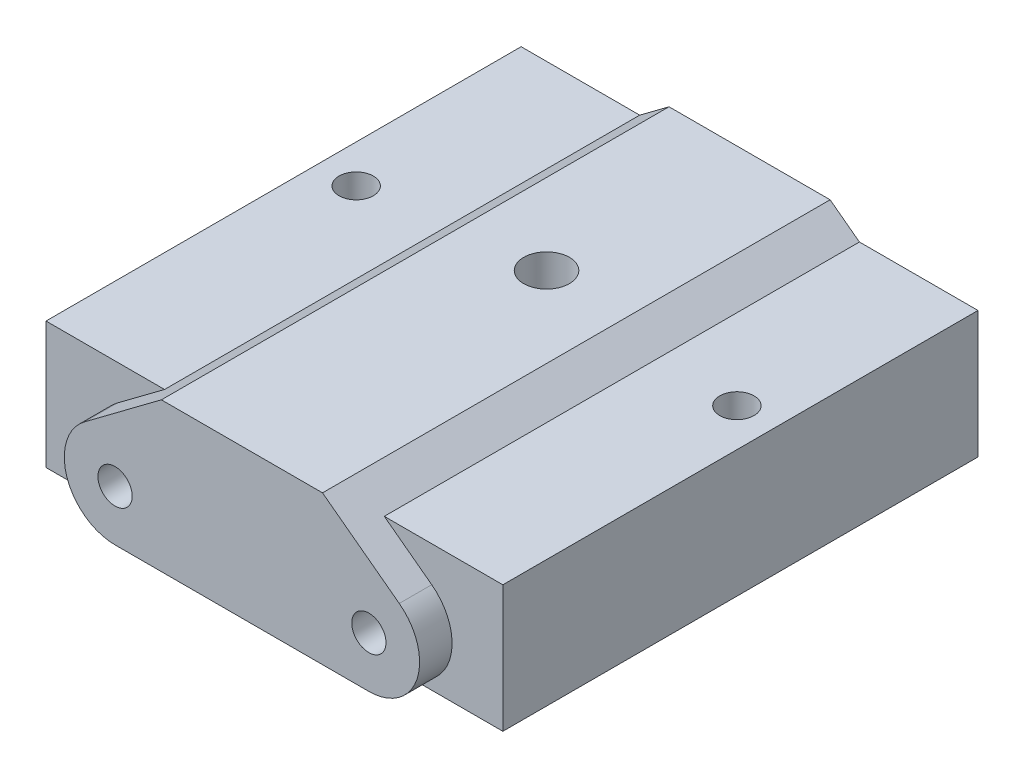
from build123d import *

# Parameters (mm, degrees)
SKETCH_1_R          = 1.35
EXTRUDE_1_DEPTH     = 40
EXTRUDE_2_DEPTH     = 10
SKETCH_3_W          = 36
SKETCH_3_H          = 37.441664415
SKETCH_3_R          = 11
EXTRUDE_3_DEPTH     = 5
SKETCH_4_R          = 1.8
CUT_EXTRUDE_1_DEPTH = 18
SKETCH_5_R          = 1.35
CUT_EXTRUDE_2_DEPTH = 18
CUT_EXTRUDE_START   = -5
SKETCH_6_R          = 11
CUT_EXTRUDE_3_DEPTH = 5
SKETCH_7_W          = 36
SKETCH_7_H          = 37.441664415
CUT_EXTRUDE_4_DEPTH = 5
CUT_EXTRUDE_START_2 = -12
SKETCH_8_R          = 1.35
CUT_EXTRUDE_5_DEPTH = 12
SKETCH_10_R         = 1.34
SKETCH_10_R_2       = 1.35
CUT_EXTRUDE_6_DEPTH = 8


with BuildPart() as part:
    # 草图1 → 凸台-拉伸1 (new body)
    with BuildSketch(Plane.XY):
        with BuildLine():
            Line((-10, -4), (10, -4))
            ThreePointArc((10, -4), (13.795550466, -1.262456597), (12.395858862, 3.203101671))
            Line((12.395858862, 3.203101671), (6.347732719, 7.726984491))
            Line((6.347732719, 7.726984491), (0, 7.726984491))
            Line((0, 7.726984491), (-6.347732719, 7.726984491))
            Line((-6.347732719, 7.726984491), (-12.395858862, 3.203101671))
            ThreePointArc((-12.395858862, 3.203101671), (-13.795550466, -1.262456597), (-10, -4))
        make_face()
        with Locations((10, 0)):
            Circle(SKETCH_1_R, mode=Mode.SUBTRACT)
        with Locations((-10, 0)):
            Circle(SKETCH_1_R, mode=Mode.SUBTRACT)
    extrude(amount=EXTRUDE_1_DEPTH)

    # 草图2 → 凸台-拉伸2 (add)
    with BuildSketch(Plane.XZ.offset(4)):
        Polygon((-10, 37.441664415), (-18, 37.441664415), (-18, 0), (0, 0), (10, 0), (18, 0), (18, 37.441664415), align=None)
    extrude(amount=-EXTRUDE_2_DEPTH)

    # 草图3 → 凸台-拉伸3 (add)
    with BuildSketch(Plane.XZ.offset(4)):
        with Locations((0, 18.720832208)):
            Rectangle(SKETCH_3_W, SKETCH_3_H)
        with Locations(Location((0, 16, 0), (0, 0, 270))):
            Circle(SKETCH_3_R, mode=Mode.SUBTRACT)
    extrude(amount=EXTRUDE_3_DEPTH)

    # 草图4 → 切除-拉伸1 (cut)
    with BuildSketch(Plane.XZ.offset(4)):
        with Locations(Location((0, 16, 0), (0, 0, 270))):
            Circle(SKETCH_4_R)
    extrude(amount=-CUT_EXTRUDE_1_DEPTH, mode=Mode.SUBTRACT)

    # 草图5 → 切除-拉伸2 (cut)
    with BuildSketch(Plane.XZ.offset(9)):
        with Locations(Location((-15, 16, 0), (0, 0, 270))):
            Circle(SKETCH_5_R)
        with Locations(Location((15, 16, 0), (0, 0, 270))):
            Circle(SKETCH_5_R)
    extrude(amount=-CUT_EXTRUDE_2_DEPTH, mode=Mode.SUBTRACT)

    # 草图6 → 切除-拉伸3 (cut)
    with BuildSketch(Plane.XZ.offset(4).offset(CUT_EXTRUDE_START)):
        with Locations(Location((0, 16, 0), (0, 0, 270))):
            Circle(SKETCH_6_R)
    extrude(amount=CUT_EXTRUDE_3_DEPTH, mode=Mode.SUBTRACT)

    # 草图7 → 切除-拉伸4 (cut)
    with BuildSketch(Plane.XZ.offset(9)):
        with Locations((0, 18.720832208)):
            Rectangle(SKETCH_7_W, SKETCH_7_H)
    extrude(amount=-CUT_EXTRUDE_4_DEPTH, mode=Mode.SUBTRACT)

    # 草图8 → 切除-拉伸5 (cut)
    with BuildSketch(Plane.XY.offset(37.441664415).offset(CUT_EXTRUDE_START_2)):
        with Locations((10, 0)):
            Circle(SKETCH_8_R)
        with Locations((-10, 0)):
            Circle(SKETCH_8_R)
    extrude(amount=CUT_EXTRUDE_5_DEPTH, mode=Mode.SUBTRACT)

    # 草图10 → 切除-拉伸6 (cut)
    with BuildSketch(Plane(origin=(0, 0, 0), x_dir=(-1, 0, 0), z_dir=(0, 0, -1))):
        with Locations((10, 0)):
            Circle(SKETCH_10_R)
        with Locations(Location((-10, 0, 0), (0, 0, 180))):
            Circle(SKETCH_10_R_2)
    extrude(amount=-CUT_EXTRUDE_6_DEPTH, mode=Mode.SUBTRACT)


solid = part.part
